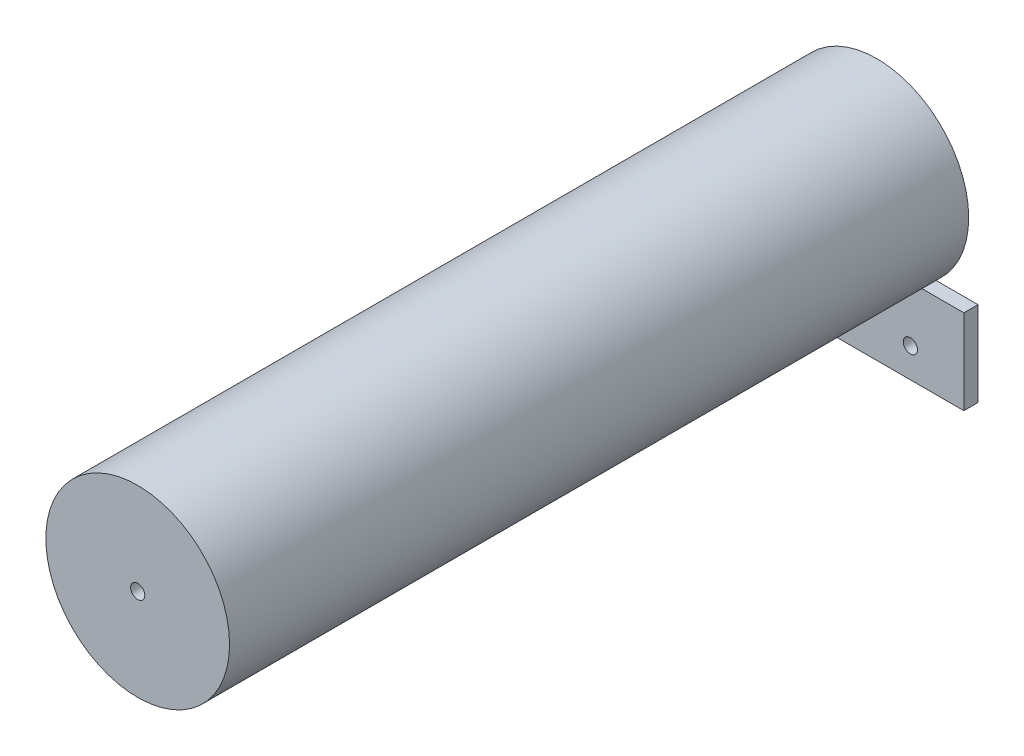
from build123d import *

# Parameters (mm, degrees)
EXTRUDEASSE_DEPTH      = 508
EXTRUDEASSE_DEPTH_BACK = 15
SKETCH1_R              = 65
SKETCH6_W              = 125.765742684
SKETCH6_H              = 20
CUT_EXTRUDE1_DEPTH     = 10
SKETCH7_W              = 76.573863029
SKETCH7_H              = 10
EXTRPIASTRINA_DEPTH    = 60
SKETCH8_R              = 5
FORO_DEPTH             = 10


with BuildPart() as part:
    # Sketch1 → ExtrudeAsse (new, two sides: drawn at the far end of the back side and taken through both)
    with BuildSketch(Plane.XY.offset(-EXTRUDEASSE_DEPTH_BACK)):
        Circle(SKETCH1_R)
    extrude(amount=EXTRUDEASSE_DEPTH + EXTRUDEASSE_DEPTH_BACK)

    # Sketch3 → Cut-Revolve1 (revolve, cut)
    with BuildSketch(Plane(origin=(0, 0, 0), x_dir=(0, 0, -1), z_dir=(1, 0, 0)), mode=Mode.PRIVATE) as cut_revolve1_sk:
        Polygon((-353.924905144, -65), (-353.924905144, 10), (-358.924905144, 12.886751346), (-358.924905144, 10), (-358.924905144, -65), align=None)
    revolve(cut_revolve1_sk.sketch.rotate(Axis((0, 12.886751346, 358.924905144), (0, -1, 0)), 180), axis=Axis((0, 12.886751346, 358.924905144), (0, -1, 0)), mode=Mode.SUBTRACT)

    # Sketch3<3> → Cut-Revolve2 (revolve, cut)
    with BuildSketch(Plane(origin=(0, 0, 0), x_dir=(0, 0, -1), z_dir=(1, 0, 0)), mode=Mode.PRIVATE) as cut_revolve2_sk:
        Polygon((-250, -65), (-245, -65), (-245, 10), (-250, 12.886751346), (-250, 0), align=None)
    revolve(cut_revolve2_sk.sketch.rotate(Axis((0, 0, 250), (0, -1, 0)), 180), axis=Axis((0, 0, 250), (0, -1, 0)), mode=Mode.SUBTRACT)

    # Sketch4 → Cut-Revolve5 (revolve, cut)
    with BuildSketch(Plane(origin=(0, 0, 0), x_dir=(0, 0, -1), z_dir=(1, 0, 0)), mode=Mode.PRIVATE) as cut_revolve5_sk:
        Polygon((-508, 0), (-237.77110668, 0), (-234.884355334, 0), (-237.77110668, -5), (-508, -5), align=None)
    revolve(cut_revolve5_sk.sketch.rotate(Axis((0, 0, 0), (0, 0, 1)), 270), axis=Axis((0, 0, 0), (0, 0, 1)), mode=Mode.SUBTRACT)

    # Sketch5 → Cut-Revolve6 (revolve, cut)
    with BuildSketch(Plane(origin=(0, 0, 0), x_dir=(0, 0, -1), z_dir=(1, 0, 0)), mode=Mode.PRIVATE) as cut_revolve6_sk:
        Polygon((15, -5), (15, 0), (-162.113248654, 0), (-165, 0), (-162.113248654, -5), align=None)
    revolve(cut_revolve6_sk.sketch.rotate(Axis((0, 0, 0), (0, 0, 1)), 90), axis=Axis((0, 0, 0), (0, 0, 1)), mode=Mode.SUBTRACT)

    # Sketch3<5> → Cut-Revolve7 (revolve, cut)
    with BuildSketch(Plane(origin=(0, 0, 0), x_dir=(0, 0, -1), z_dir=(1, 0, 0))):
        Polygon((-142, 10), (-142, 12.886751346), (-137, 10), (-137, -65), (-142, -65), align=None)
    revolve(axis=Axis((0, -65, 142), (0, 1, 0)), mode=Mode.SUBTRACT)

    # Sketch6 → Cut-Extrude1 (cut)
    with BuildSketch(Plane(origin=(0, 0, 0), x_dir=(-1, 0, 0), z_dir=(0, 0, -1))):
        with Locations((-8.867505506, -55)):
            Rectangle(SKETCH6_W, SKETCH6_H)
    extrude(amount=CUT_EXTRUDE1_DEPTH, mode=Mode.SUBTRACT)


with BuildPart() as body_2:
    # Sketch7 → ExtrPiastrina (new body)
    with BuildSketch(Plane.XZ.offset(45)):
        with Locations((-38.286931515, -5)):
            Rectangle(SKETCH7_W, SKETCH7_H)
    extrude(amount=EXTRPIASTRINA_DEPTH)

    # Sketch8 → Foro (cut)
    with BuildSketch(Plane(origin=(0, 0, -10), x_dir=(-1, 0, 0), z_dir=(0, 0, -1))):
        with Locations((38.692667282, -84.131323576)):
            Circle(SKETCH8_R)
    extrude(amount=-FORO_DEPTH, mode=Mode.SUBTRACT)

    # Mirror1: body 2 across plane


with BuildPart() as body_2_1:
    add(body_2.part)
    add(body_2.part.mirror(Plane(origin=(0, -105, -10), x_dir=(0, 0, 1), z_dir=(-1, 0, 0))))


solid = Compound([part.part, body_2_1.part])
